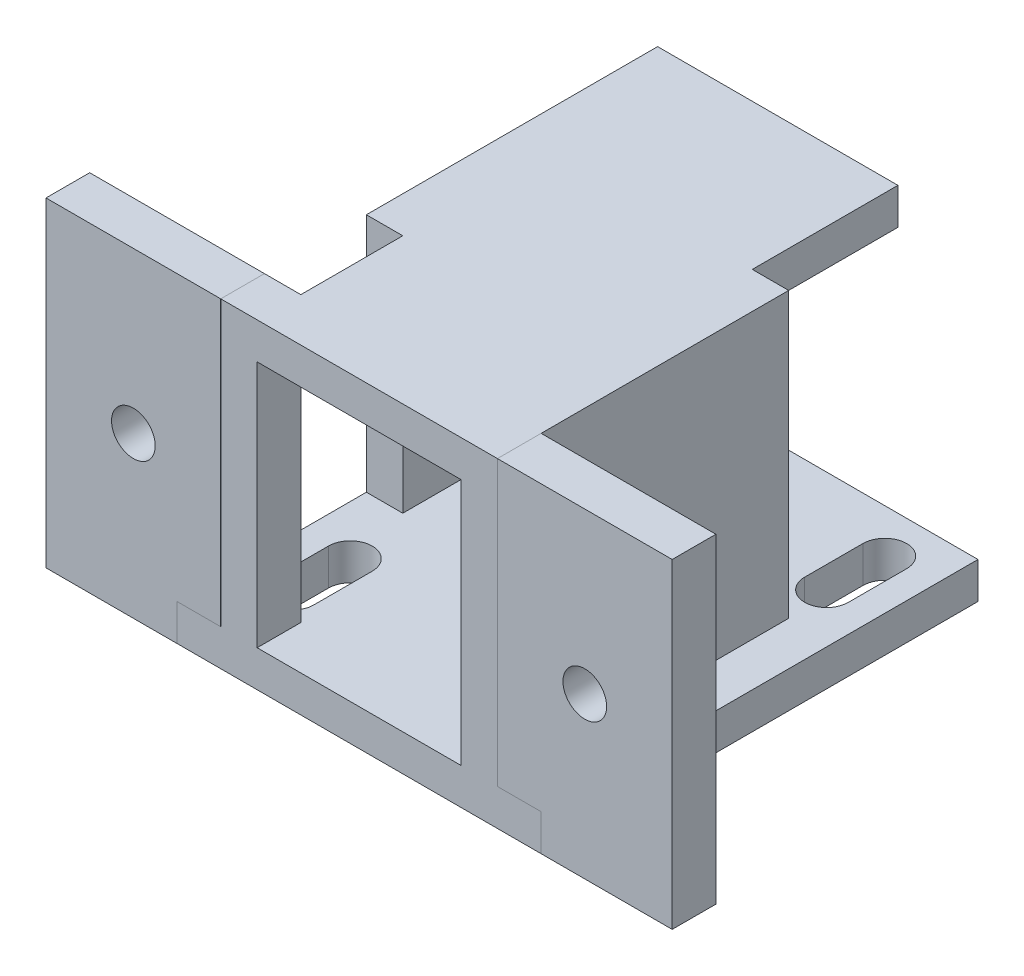
from build123d import *

# Parameters (mm, degrees)
SKETCH1_W           = 19
SKETCH1_H           = 22
SKETCH1_W_2         = 14
SKETCH1_H_2         = 17
SKETCH1_W_3         = 3
SKETCH1_H_3         = 2.5
BOSS_EXTRUDE1_DEPTH = 30
SKETCH2_W           = 7
SKETCH2_H           = 16.5
CUT_EXTRUDE1_DEPTH  = 2.5
SKETCH3_W           = 10
SKETCH3_H           = 16.5
SKETCH3_H_2         = 3
CUT_EXTRUDE2_DEPTH  = 2.5
CUT_EXTRUDE3_DEPTH  = 38.901187316
SKETCH6_R           = 1.5
SKETCH6_W           = 9
SKETCH6_H           = 2.5
BOSS_EXTRUDE2_DEPTH = 3


with BuildPart() as part:
    # Sketch1 → Boss-Extrude1 (new body)
    # profile 1 of 3: a face of its own
    with BuildSketch(Plane.XY):
        Rectangle(SKETCH1_W, SKETCH1_H)
        Rectangle(SKETCH1_W_2, SKETCH1_H_2, mode=Mode.SUBTRACT)
    # profile 2 of 3: a face of its own
    with BuildSketch(Plane.XY):
        with Locations((-11, -9.75)):
            Rectangle(SKETCH1_W_3, SKETCH1_H_3)
    # profile 3 of 3: a face of its own
    with BuildSketch(Plane.XY):
        with Locations((11, -9.75)):
            Rectangle(SKETCH1_W_3, SKETCH1_H_3)
    extrude(amount=BOSS_EXTRUDE1_DEPTH)

    # Sketch2 → Cut-Extrude1 (cut)
    with BuildSketch(Plane.ZY.offset(9.5)):
        Polygon((27.000006, -8.5), (27.000006, -5.5), (20.000006, -5.5), (0, -5.5), (0, -8.5), align=None)
        with Locations((23.500006, 2.75)):
            Rectangle(SKETCH2_W, SKETCH2_H)
    extrude(amount=-CUT_EXTRUDE1_DEPTH, mode=Mode.SUBTRACT)

    # Sketch3 → Cut-Extrude2 (cut)
    with BuildSketch(Plane(origin=(9.5, 0, 0), x_dir=(0, 0, -1), z_dir=(1, 0, 0))):
        with Locations((-5, 2.75)):
            Rectangle(SKETCH3_W, SKETCH3_H)
        with Locations((-5, -7)):
            Rectangle(SKETCH3_W, SKETCH3_H_2)
    extrude(amount=-CUT_EXTRUDE2_DEPTH, mode=Mode.SUBTRACT)

    # Sketch5 → Cut-Extrude3 (cut, through all)
    with BuildSketch(Plane(origin=(0, -8.5, 0), x_dir=(1, 0, 0), z_dir=(0, 1, 0))):
        with BuildLine():
            Line((-10.6, -25.500006), (-10.6, -21.500006))
            ThreePointArc((-10.6, -21.500006), (-9.1, -20.000006), (-7.6, -21.500006))
            Line((-7.6, -21.500006), (-7.6, -25.500006))
            ThreePointArc((-7.6, -25.500006), (-9.1, -27.000006), (-10.6, -25.500006))
        make_face()
        with BuildLine():
            Line((7.6, -7), (7.6, -3))
            ThreePointArc((7.6, -3), (9.1, -1.5), (10.6, -3))
            Line((10.6, -3), (10.6, -7))
            ThreePointArc((10.6, -7), (9.1, -8.5), (7.6, -7))
        make_face()
    extrude(amount=-CUT_EXTRUDE3_DEPTH, mode=Mode.SUBTRACT)


with BuildPart() as body_2:
    # Sketch6 → Boss-Extrude2 (new body)
    # profile 1 of 4: a face of its own
    with BuildSketch(Plane.XY.offset(30)):
        Polygon((-9.5, -8.5), (-9.5, 11), (-21.5, 11), (-21.5, -8.5), (-12.5, -8.5), align=None)
        with Locations((-15.5, 0)):
            Circle(SKETCH6_R, mode=Mode.SUBTRACT)
    # profile 2 of 4: a face of its own
    with BuildSketch(Plane.XY.offset(30)):
        with Locations((-17, -9.75)):
            Rectangle(SKETCH6_W, SKETCH6_H)
    # profile 3 of 4: a face of its own
    with BuildSketch(Plane.XY.offset(30)):
        with Locations((17, -9.75)):
            Rectangle(SKETCH6_W, SKETCH6_H)
    # profile 4 of 4: a face of its own
    with BuildSketch(Plane.XY.offset(30)):
        Polygon((21.5, 11), (9.5, 11), (9.5, -8.5), (12.5, -8.5), (21.5, -8.5), align=None)
        with Locations((15.5, 0)):
            Circle(SKETCH6_R, mode=Mode.SUBTRACT)
    extrude(amount=-BOSS_EXTRUDE2_DEPTH)


solid = Compound([part.part, body_2.part])
